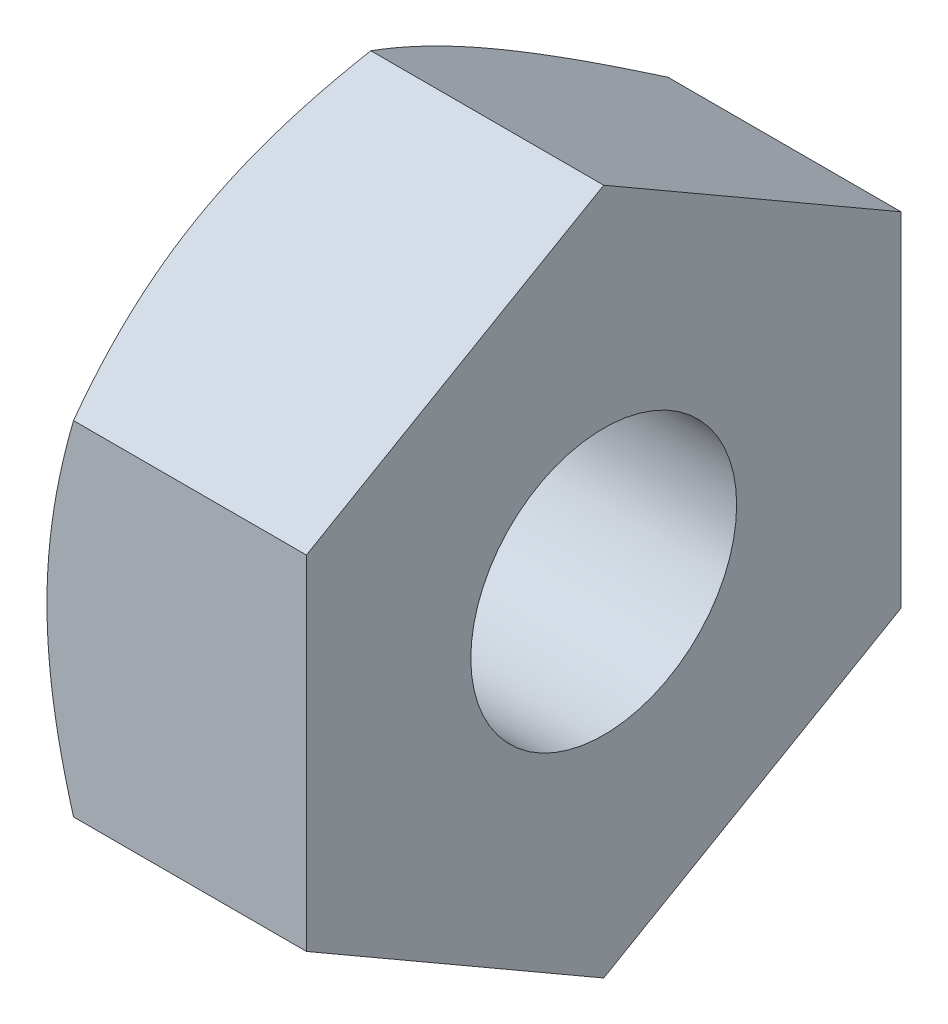
from build123d import *

# Parameters (mm, degrees)
BOSS_EXTRUDE1_DEPTH = 2.4
TAP1_D              = 2.459


with BuildPart() as part:
    # Sketch1 → Boss-Extrude1 (new body)
    with BuildSketch(Plane(origin=(0, 0, 0), x_dir=(0, 0, -1), z_dir=(1, 0, 0))):
        Polygon((0, 3.175426481), (-2.75, 1.58771324), (-2.75, -1.58771324), (0, -3.175426481), (2.75, -1.58771324), (2.75, 1.58771324), align=None)
    extrude(amount=-BOSS_EXTRUDE1_DEPTH)

    # Sketch2 → Cut-Revolve1 (revolve, cut)
    with BuildSketch(Plane.XY):
        Polygon((-2.4, 2.75), (-2.154379907, 3.175426481), (-2.4, 3.175426481), align=None)
    revolve(axis=Axis((-2.23854625, 0, 0), (1, 0, 0)), mode=Mode.SUBTRACT)

    # Tap1 (through all)
    with Locations(Plane.ZY.offset(2.4)):
        with Locations((0, 0)):
            Hole(TAP1_D / 2)


solid = part.part
